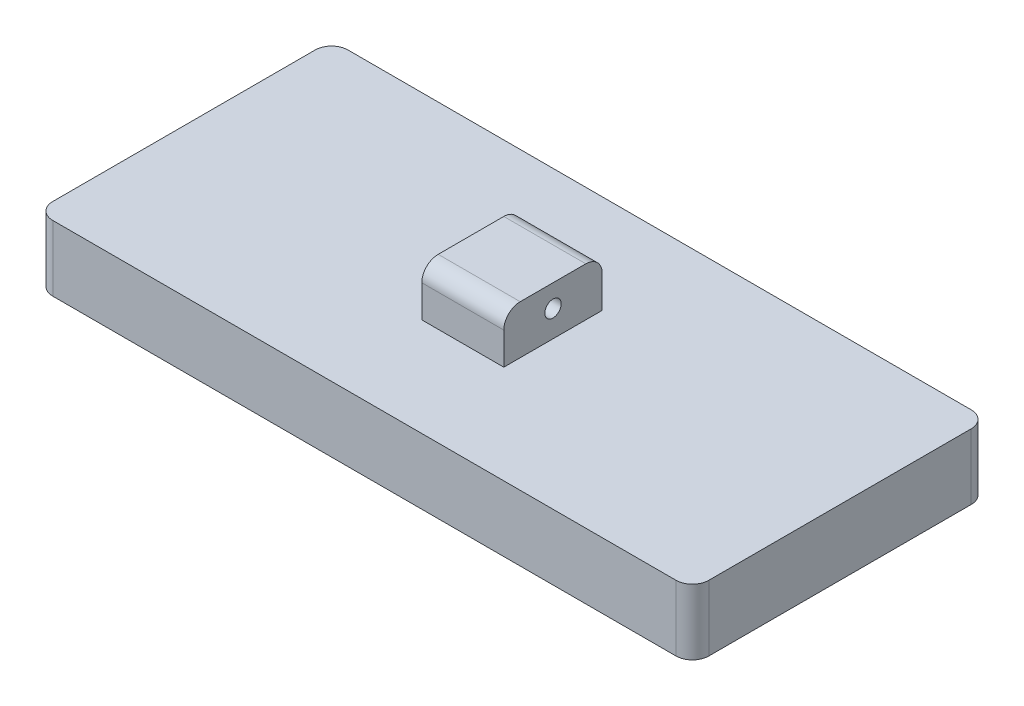
from build123d import *

# Parameters (mm, degrees)
SKETCH1_W           = 200
SKETCH1_H           = 90
BOSS_EXTRUDE1_DEPTH = 20
FILLET1_R           = 5
SKETCH2_W           = 25
SKETCH2_H           = 30
BOSS_EXTRUDE2_DEPTH = 14.8
FILLET2_R           = 5
CUT_EXTRUDE1_DEPTH  = 10
CUT_EXTRUDE2_REACH  = 150.214
SKETCH4_R           = 2.5


with BuildPart() as part:
    # Sketch1 → Boss-Extrude1 (new body)
    with BuildSketch(Plane(origin=(0, 0, 0), x_dir=(1, 0, 0), z_dir=(0, 1, 0))):
        with Locations((100, 45)):
            Rectangle(SKETCH1_W, SKETCH1_H)
    extrude(amount=BOSS_EXTRUDE1_DEPTH)

    # Fillet1
    fillet1_edges = [part.edges().sort_by_distance(p)[0] for p in [
        (0, 10, -90),
        (200, 10, -90),
        (200, 10, 0),
        (0, 10, 0),
    ]]
    fillet(fillet1_edges, radius=FILLET1_R)

    # Sketch2 → Boss-Extrude2 (add)
    with BuildSketch(Plane(origin=(0, 20, 0), x_dir=(1, 0, 0), z_dir=(0, 1, 0))):
        with Locations((100, 45)):
            Rectangle(SKETCH2_W, SKETCH2_H)
    extrude(amount=BOSS_EXTRUDE2_DEPTH)

    # Fillet2
    fillet2_edges = [part.edges().sort_by_distance(p)[0] for p in [
        (100, 34.8, -30),
        (100, 34.8, -60),
    ]]
    fillet(fillet2_edges, radius=FILLET2_R)

    # Sketch3 → Cut-Extrude1 (cut)
    with BuildSketch(Plane.ZY.offset(-87.5)):
        Polygon((-49.561067127, 28), (-47.280533563, 24.05), (-42.719466437, 24.05), (-40.438932873, 28), (-42.719466437, 31.95), (-47.280533563, 31.95), align=None)
    extrude(amount=-CUT_EXTRUDE1_DEPTH, mode=Mode.SUBTRACT)

    # Sketch4 → Cut-Extrude2 (cut, up to next)
    with BuildSketch(Plane.ZY.offset(-87.5), mode=Mode.PRIVATE) as cut_extrude2_sk1:
        with Locations((-45, 28)):
            Circle(SKETCH4_R)
    cut_extrude2_tool1 = extrude(cut_extrude2_sk1.sketch, amount=-CUT_EXTRUDE2_REACH, mode=Mode.PRIVATE) & part.part
    add(cut_extrude2_tool1.solids().sort_by_distance((87.5, 28, -45))[0], mode=Mode.SUBTRACT)


solid = part.part
